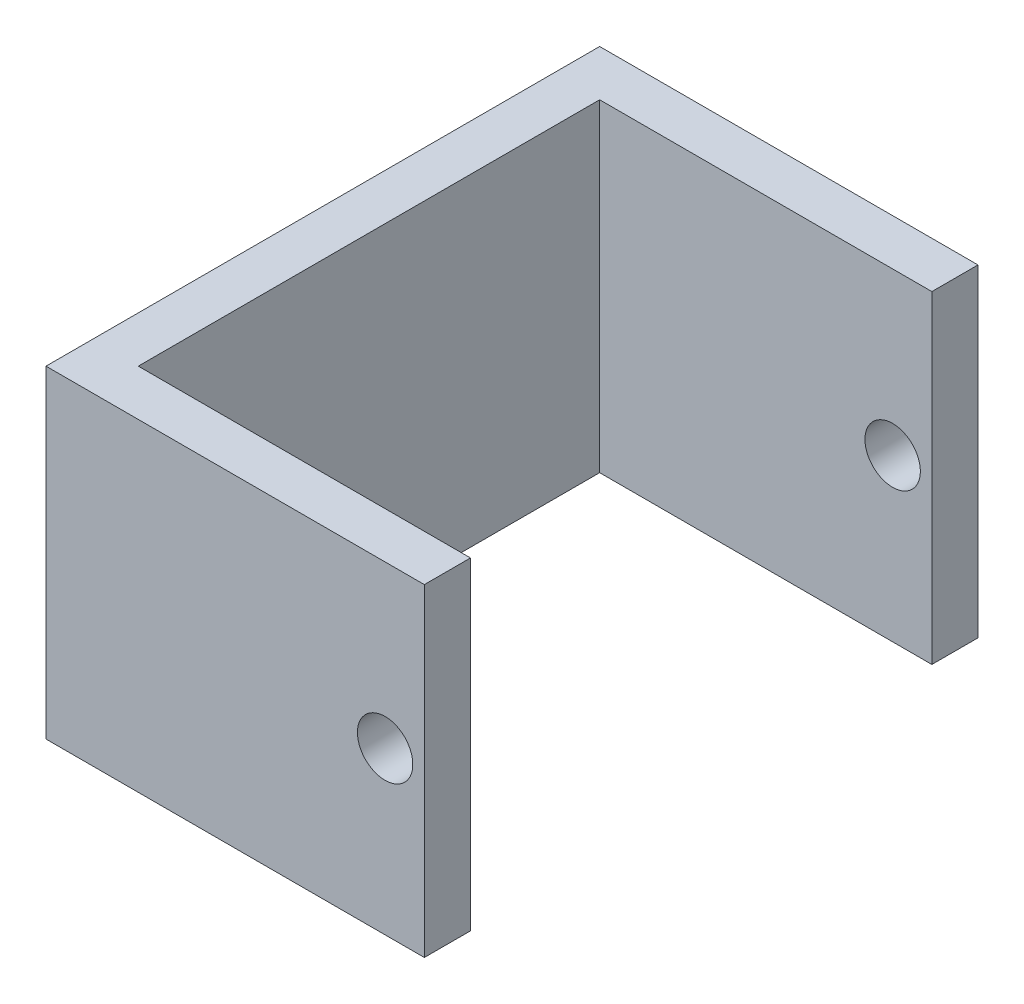
from build123d import *

# Parameters (mm, degrees)
SKETCH1_W               = 70
SKETCH1_H               = 120
BOSS_EXTRUDE3_DEPTH     = 10
SKETCH3_W               = 70
SKETCH3_H               = 10
BOSS_EXTRUDE4_DEPTH     = 72
CUT_EXTRUDE1_DEPTH      = 150.49581934
CUT_EXTRUDE1_DEPTH_BACK = 150.49581934
SKETCH4_R               = 6


with BuildPart() as part:
    # Sketch1 → Boss-Extrude3 (new body)
    with BuildSketch(Plane.YZ):
        Rectangle(SKETCH1_W, SKETCH1_H)
    extrude(amount=BOSS_EXTRUDE3_DEPTH)

    # Sketch3 → Boss-Extrude4 (add)
    with BuildSketch(Plane.YZ.offset(10)):
        with Locations((0, 55)):
            Rectangle(SKETCH3_W, SKETCH3_H)
        with Locations((0, -55)):
            Rectangle(SKETCH3_W, SKETCH3_H)
    extrude(amount=BOSS_EXTRUDE4_DEPTH)

    # Sketch4 → Cut-Extrude1 (cut, two sides: drawn at the far end of the back side and taken through both)
    with BuildSketch(Plane(origin=(0, 0, -60), x_dir=(1, 0, 0), z_dir=(0, 0, -1)).offset(-CUT_EXTRUDE1_DEPTH_BACK)):
        with Locations(Location((73.5, 0, 0), (0, 0, 180))):
            Circle(SKETCH4_R)
    extrude(amount=CUT_EXTRUDE1_DEPTH + CUT_EXTRUDE1_DEPTH_BACK, mode=Mode.SUBTRACT)


solid = part.part
